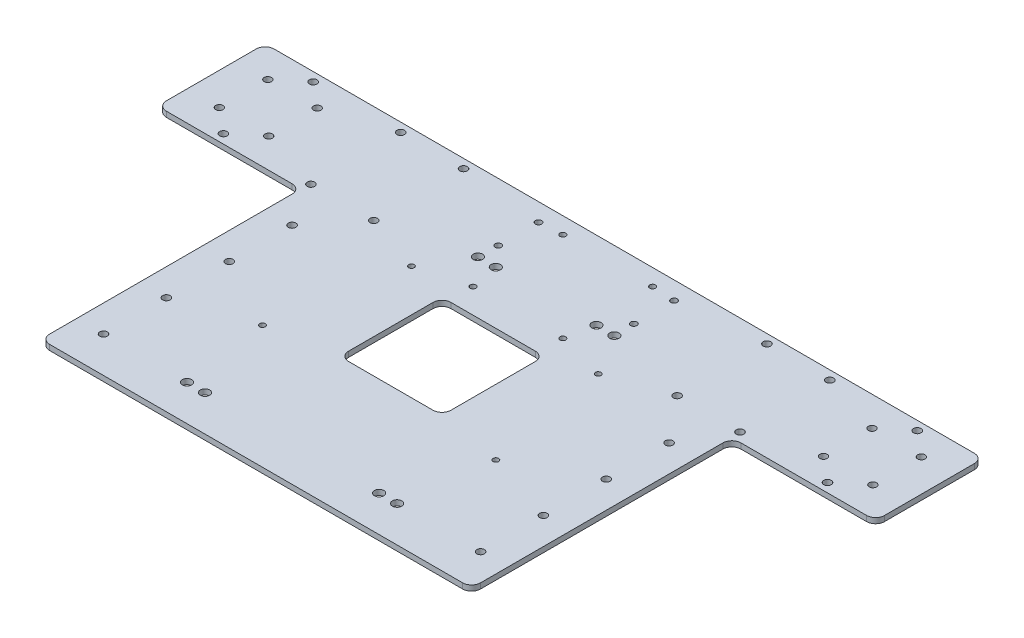
from build123d import *

# Parameters (mm, degrees)
SKETCH_1_R          = 1.6
SKETCH_1_W          = 57
SKETCH_1_H          = 57
EXTRUDE_1451_DEPTH  = 3
SKETCH_2_R          = 2.05
SKETCH_2_R_2        = 2.1
CUT_EXTRUDE_1_DEPTH = 287.415781688
FILLET_1_R          = 5
SKETCH_3_R          = 2.1
SKETCH_3_R_2        = 1.55
SKETCH_3_R_3        = 2.6
CUT_EXTRUDE_2_DEPTH = 287.415781688
SKETCH_4_R          = 1.75
CUT_EXTRUDE_3_DEPTH = 10


with BuildPart() as part:
    # 草图1 → Extrude 1451 (new body)
    # profile 1 of 2: a face of its own
    with BuildSketch(Plane(origin=(0, 0, 0), x_dir=(1, 0, 0), z_dir=(0, 1, 0))):
        with BuildLine():
            Line((-200, 0), (-200, -60))
            Line((-200, -60), (-120, -60))
            Line((-120, -60), (-26.385640646, -60))
            ThreePointArc((-26.385640646, -60), (-25.414110472, -57.654518678), (-23.4, -59.2))
            ThreePointArc((-23.4, -59.2), (-23.454518678, -59.614110472), (-23.614359354, -60))
            Line((-23.614359354, -60), (23.614359354, -60))
            ThreePointArc((23.614359354, -60), (24.585889528, -57.654518678), (26.6, -59.2))
            ThreePointArc((26.6, -59.2), (26.545481322, -59.614110472), (26.385640646, -60))
            Line((26.385640646, -60), (120, -60))
            Line((120, -60), (200, -60))
            Line((200, -60), (200, 0))
            Line((200, 0), (-200, 0))
        make_face()
        with Locations(Location((-25, -9.2, 0), (0, 0, 270))):
            Circle(SKETCH_1_R, mode=Mode.SUBTRACT)
        with Locations(Location((25, -9.2, 0), (0, 0, 270))):
            Circle(SKETCH_1_R, mode=Mode.SUBTRACT)
    # profile 2 of 2: a face of its own
    with BuildSketch(Plane(origin=(0, 0, 0), x_dir=(1, 0, 0), z_dir=(0, 1, 0))):
        with BuildLine():
            Line((-26.385640646, -60), (-120, -60))
            Line((-120, -60), (-120, -205))
            Line((-120, -205), (120, -205))
            Line((120, -205), (120, -60))
            Line((120, -60), (26.385640646, -60))
            ThreePointArc((26.385640646, -60), (25, -60.8), (23.614359354, -60))
            Line((23.614359354, -60), (-23.614359354, -60))
            ThreePointArc((-23.614359354, -60), (-25, -60.8), (-26.385640646, -60))
        make_face()
        with Locations((0, -101.5)):
            Rectangle(SKETCH_1_W, SKETCH_1_H, mode=Mode.SUBTRACT)
    extrude(amount=EXTRUDE_1451_DEPTH)

    # 草图2 → 切除-拉伸1 (cut, through all)
    with BuildSketch(Plane(origin=(0, 3, 0), x_dir=(1, 0, 0), z_dir=(0, 1, 0))):
        with Locations(Location((-182, -16.5, 0), (0, 0, 270))):
            Circle(SKETCH_2_R)
        with Locations(Location((-182, -43.5, 0), (0, 0, 270))):
            Circle(SKETCH_2_R)
        with Locations(Location((-154.5, -16.5, 0), (0, 0, 270))):
            Circle(SKETCH_2_R)
        with Locations(Location((-154.5, -43.5, 0), (0, 0, 90))):
            Circle(SKETCH_2_R)
        with Locations(Location((-84.5, -5, 0), (0, 0, 270))):
            Circle(SKETCH_2_R_2)
        with Locations(Location((-119.5, -5, 0), (0, 0, 270))):
            Circle(SKETCH_2_R_2)
        with Locations(Location((-84.5, -55, 0), (0, 0, 90))):
            Circle(SKETCH_2_R_2)
        with Locations(Location((-119.5, -55, 0), (0, 0, 90))):
            Circle(SKETCH_2_R_2)
        with Locations(Location((-168.25, -5, 0), (0, 0, 270))):
            Circle(SKETCH_2_R_2)
        with Locations(Location((-168.25, -55, 0), (0, 0, 90))):
            Circle(SKETCH_2_R_2)
        with Locations(Location((168.25, -55, 0), (0, 0, 270))):
            Circle(SKETCH_2_R_2)
        with Locations(Location((168.25, -5, 0), (0, 0, 90))):
            Circle(SKETCH_2_R_2)
        with Locations(Location((119.5, -55, 0), (0, 0, 270))):
            Circle(SKETCH_2_R_2)
        with Locations(Location((84.5, -55, 0), (0, 0, 270))):
            Circle(SKETCH_2_R_2)
        with Locations(Location((119.5, -5, 0), (0, 0, 90))):
            Circle(SKETCH_2_R_2)
        with Locations(Location((84.5, -5, 0), (0, 0, 90))):
            Circle(SKETCH_2_R_2)
        with Locations(Location((154.5, -43.5, 0), (0, 0, 270))):
            Circle(SKETCH_2_R)
        with Locations(Location((154.5, -16.5, 0), (0, 0, 90))):
            Circle(SKETCH_2_R)
        with Locations(Location((182, -43.5, 0), (0, 0, 90))):
            Circle(SKETCH_2_R)
        with Locations(Location((182, -16.5, 0), (0, 0, 90))):
            Circle(SKETCH_2_R)
    extrude(amount=-CUT_EXTRUDE_1_DEPTH, mode=Mode.SUBTRACT)

    # 圆角1
    fillet_1_edges = [part.edges().sort_by_distance(p)[0] for p in [
        (-28.5, 1.5, 73),
        (-28.5, 1.5, 130),
        (28.5, 1.5, 130),
        (28.5, 1.5, 73),
        (120, 1.5, 205),
        (-120, 1.5, 205),
        (-120, 1.5, 60),
        (-200, 1.5, 60),
        (-200, 1.5, 0),
        (200, 1.5, 0),
        (200, 1.5, 60),
        (120, 1.5, 60),
    ]]
    fillet(fillet_1_edges, radius=FILLET_1_R)

    # 草图3 → 切除-拉伸2 (cut, through all)
    with BuildSketch(Plane(origin=(0, 3, 0), x_dir=(1, 0, 0), z_dir=(0, 1, 0))):
        with Locations(Location((-105, -80, 0), (0, 0, 270))):
            Circle(SKETCH_3_R)
        with Locations(Location((-105, -115, 0), (0, 0, 270))):
            Circle(SKETCH_3_R)
        with Locations(Location((-105, -150, 0), (0, 0, 270))):
            Circle(SKETCH_3_R)
        with Locations(Location((-105, -185, 0), (0, 0, 270))):
            Circle(SKETCH_3_R)
        with Locations(Location((105, -185, 0), (0, 0, 90))):
            Circle(SKETCH_3_R)
        with Locations(Location((105, -150, 0), (0, 0, 90))):
            Circle(SKETCH_3_R)
        with Locations(Location((105, -115, 0), (0, 0, 90))):
            Circle(SKETCH_3_R)
        with Locations(Location((105, -80, 0), (0, 0, 90))):
            Circle(SKETCH_3_R)
        with Locations(Location((-52, -66.5, 0), (0, 0, 270))):
            Circle(SKETCH_3_R_2)
        with Locations(Location((-65, -136.5, 0), (0, 0, 270))):
            Circle(SKETCH_3_R_2)
        with Locations(Location((65, -136.5, 0), (0, 0, 90))):
            Circle(SKETCH_3_R_2)
        with Locations(Location((52, -66.5, 0), (0, 0, 90))):
            Circle(SKETCH_3_R_2)
        with Locations(Location((-38, -43.5, 0), (0, 0, 270))):
            Circle(SKETCH_3_R_3)
        with Locations(Location((-28, -43.5, 0), (0, 0, 270))):
            Circle(SKETCH_3_R_3)
        with Locations(Location((28, -43.5, 0), (0, 0, 90))):
            Circle(SKETCH_3_R_3)
        with Locations(Location((38, -43.5, 0), (0, 0, 90))):
            Circle(SKETCH_3_R_3)
        with Locations(Location((-58.5, -185, 0), (0, 0, 270))):
            Circle(SKETCH_3_R_3)
        with Locations(Location((-48.5, -185, 0), (0, 0, 270))):
            Circle(SKETCH_3_R_3)
        with Locations(Location((48.5, -185, 0), (0, 0, 90))):
            Circle(SKETCH_3_R_3)
        with Locations(Location((58.5, -185, 0), (0, 0, 90))):
            Circle(SKETCH_3_R_3)
    extrude(amount=-CUT_EXTRUDE_2_DEPTH, mode=Mode.SUBTRACT)

    # 草图4 → 切除-拉伸3 (cut)
    with BuildSketch(Plane(origin=(0, 3, 0), x_dir=(1, 0, 0), z_dir=(0, 1, 0))):
        with Locations(Location((-37.75, -10, 0), (0, 0, 270))):
            Circle(SKETCH_4_R)
        with Locations(Location((37.75, -10, 0), (0, 0, 270))):
            Circle(SKETCH_4_R)
        with Locations(Location((-37.75, -32.4, 0), (0, 0, 270))):
            Circle(SKETCH_4_R)
        with Locations(Location((37.75, -32.4, 0), (0, 0, 270))):
            Circle(SKETCH_4_R)
    extrude(amount=-CUT_EXTRUDE_3_DEPTH, mode=Mode.SUBTRACT)


solid = part.part
